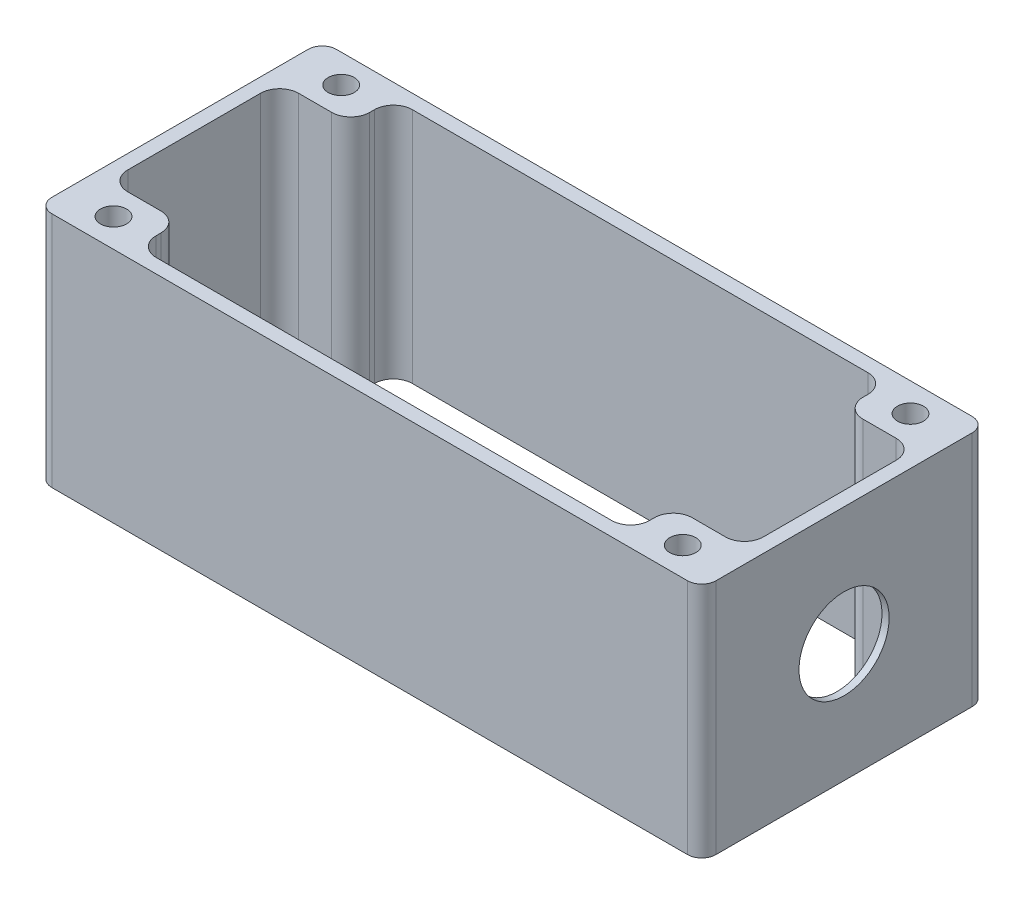
from build123d import *

# Parameters (mm, degrees)
SKETCH1_R           = 2.75
SKETCH1_W           = 130
SKETCH1_H           = 38
BOSS_EXTRUDE1_DEPTH = 10
SKETCH1_2_W         = 130
SKETCH1_2_H         = 38
BOSS_EXTRUDE2_DEPTH = 10
SKETCH14_W          = 15
SKETCH14_H          = 36
SKETCH14_W_2        = 104
SKETCH14_H_2        = 9
CUT_EXTRUDE2_DEPTH  = 77.811457479
FILLET2_R           = 4
SKETCH15_R          = 2.75
BOSS_EXTRUDE3_DEPTH = 40
CUT_EXTRUDE3_REACH  = 153.658
SKETCH16_R          = 9.5
SKETCH17_R          = 13.5
CUT_EXTRUDE4_DEPTH  = 1.5


with BuildPart() as part:
    # Sketch1 → Boss-Extrude1 (new body)
    with BuildSketch(Plane(origin=(0, 0, 0), x_dir=(1, 0, 0), z_dir=(0, 1, 0))):
        with BuildLine():
            Line((67, 30), (-67, 30))
            ThreePointArc((-67, 30), (-69.121320344, 29.121320344), (-70, 27))
            Line((-70, 27), (-70, -27))
            ThreePointArc((-70, -27), (-69.121320344, -29.121320344), (-67, -30))
            Line((-67, -30), (67, -30))
            ThreePointArc((67, -30), (69.121320344, -29.121320344), (70, -27))
            Line((70, -27), (70, 27))
            ThreePointArc((70, 27), (69.121320344, 29.121320344), (67, 30))
        make_face()
        with Locations(Location((-60, 24, 0), (0, 0, 270))):
            Circle(SKETCH1_R, mode=Mode.SUBTRACT)
        with Locations(Location((-60, -24, 0), (0, 0, 270))):
            Circle(SKETCH1_R, mode=Mode.SUBTRACT)
        with Locations(Location((60, -24, 0), (0, 0, 270))):
            Circle(SKETCH1_R, mode=Mode.SUBTRACT)
        with Locations(Location((60, 24, 0), (0, 0, 270))):
            Circle(SKETCH1_R, mode=Mode.SUBTRACT)
        Rectangle(SKETCH1_W, SKETCH1_H, mode=Mode.SUBTRACT)
    extrude(amount=BOSS_EXTRUDE1_DEPTH)

    # Sketch1<2> → Boss-Extrude2 (add)
    with BuildSketch(Plane(origin=(0, 0, 0), x_dir=(1, 0, 0), z_dir=(0, 1, 0))):
        Rectangle(SKETCH1_2_W, SKETCH1_2_H)
    extrude(amount=BOSS_EXTRUDE2_DEPTH)

    # Sketch14 → Cut-Extrude2 (cut, through all)
    with BuildSketch(Plane(origin=(0, 10, 0), x_dir=(1, 0, 0), z_dir=(0, 1, 0))):
        with Locations((-59.5, 0)):
            Rectangle(SKETCH14_W, SKETCH14_H)
        Rectangle(SKETCH14_W_2, SKETCH14_H)
        with Locations((0, 22.5)):
            Rectangle(SKETCH14_W_2, SKETCH14_H_2)
        with Locations((59.5, 0)):
            Rectangle(SKETCH14_W, SKETCH14_H)
        with Locations((0, -22.5)):
            Rectangle(SKETCH14_W_2, SKETCH14_H_2)
    extrude(amount=-CUT_EXTRUDE2_DEPTH, mode=Mode.SUBTRACT)

    # Fillet2
    fillet2_edges = [part.edges().sort_by_distance(p)[0] for p in [
        (-67, 5, 18),
        (-67, 5, -18),
        (-52, 5, -18),
        (-52, 5, -27),
        (52, 5, -27),
        (52, 5, -18),
        (67, 5, -18),
        (67, 5, 18),
        (52, 5, 18),
        (52, 5, 27),
        (-52, 5, 27),
        (-52, 5, 18),
    ]]
    fillet(fillet2_edges, radius=FILLET2_R)

    # Sketch15 → Boss-Extrude3 (add)
    with BuildSketch(Plane(origin=(0, 10, 0), x_dir=(1, 0, 0), z_dir=(0, 1, 0))):
        with BuildLine():
            Line((67, 30), (-67, 30))
            ThreePointArc((-67, 30), (-69.121320344, 29.121320344), (-70, 27))
            Line((-70, 27), (-70, -27))
            ThreePointArc((-70, -27), (-69.121320344, -29.121320344), (-67, -30))
            Line((-67, -30), (67, -30))
            ThreePointArc((67, -30), (69.121320344, -29.121320344), (70, -27))
            Line((70, -27), (70, 27))
            ThreePointArc((70, 27), (69.121320344, 29.121320344), (67, 30))
        make_face()
        with Locations(Location((-60, 24, 0), (0, 0, 270))):
            Circle(SKETCH15_R, mode=Mode.SUBTRACT)
        with Locations(Location((-60, -24, 0), (0, 0, 270))):
            Circle(SKETCH15_R, mode=Mode.SUBTRACT)
        with Locations(Location((60, -24, 0), (0, 0, 270))):
            Circle(SKETCH15_R, mode=Mode.SUBTRACT)
        with Locations(Location((60, 24, 0), (0, 0, 270))):
            Circle(SKETCH15_R, mode=Mode.SUBTRACT)
        with BuildLine():
            Line((56, -18), (63, -18))
            ThreePointArc((63, -18), (65.828427125, -16.828427125), (67, -14))
            Line((67, -14), (67, 14))
            ThreePointArc((67, 14), (65.828427125, 16.828427125), (63, 18))
            Line((63, 18), (56, 18))
            ThreePointArc((56, 18), (53.171572875, 19.171572875), (52, 22))
            Line((52, 22), (52, 23))
            ThreePointArc((52, 23), (50.828427125, 25.828427125), (48, 27))
            Line((48, 27), (-48, 27))
            ThreePointArc((-48, 27), (-50.828427125, 25.828427125), (-52, 23))
            Line((-52, 23), (-52, 22))
            ThreePointArc((-52, 22), (-53.171572875, 19.171572875), (-56, 18))
            Line((-56, 18), (-63, 18))
            ThreePointArc((-63, 18), (-65.828427125, 16.828427125), (-67, 14))
            Line((-67, 14), (-67, -14))
            ThreePointArc((-67, -14), (-65.828427125, -16.828427125), (-63, -18))
            Line((-63, -18), (-56, -18))
            ThreePointArc((-56, -18), (-53.171572875, -19.171572875), (-52, -22))
            Line((-52, -22), (-52, -23))
            ThreePointArc((-52, -23), (-50.828427125, -25.828427125), (-48, -27))
            Line((-48, -27), (48, -27))
            ThreePointArc((48, -27), (50.828427125, -25.828427125), (52, -23))
            Line((52, -23), (52, -22))
            ThreePointArc((52, -22), (53.171572875, -19.171572875), (56, -18))
        make_face(mode=Mode.SUBTRACT)
    extrude(amount=BOSS_EXTRUDE3_DEPTH)

    # Sketch16 → Cut-Extrude3 (cut, up to next)
    with BuildSketch(Plane(origin=(70, 0, 0), x_dir=(0, 0, -1), z_dir=(1, 0, 0)), mode=Mode.PRIVATE) as cut_extrude3_sk1:
        with Locations((0, 25)):
            Circle(SKETCH16_R)
    cut_extrude3_tool1 = extrude(cut_extrude3_sk1.sketch, amount=-CUT_EXTRUDE3_REACH, mode=Mode.PRIVATE) & part.part
    add(cut_extrude3_tool1.solids().sort_by_distance((70, 25, 0))[0], mode=Mode.SUBTRACT)

    # Sketch17 → Cut-Extrude4 (cut)
    with BuildSketch(Plane.ZY.offset(-67)):
        with Locations((0, 25)):
            Circle(SKETCH17_R)
    extrude(amount=-CUT_EXTRUDE4_DEPTH, mode=Mode.SUBTRACT)


solid = part.part
